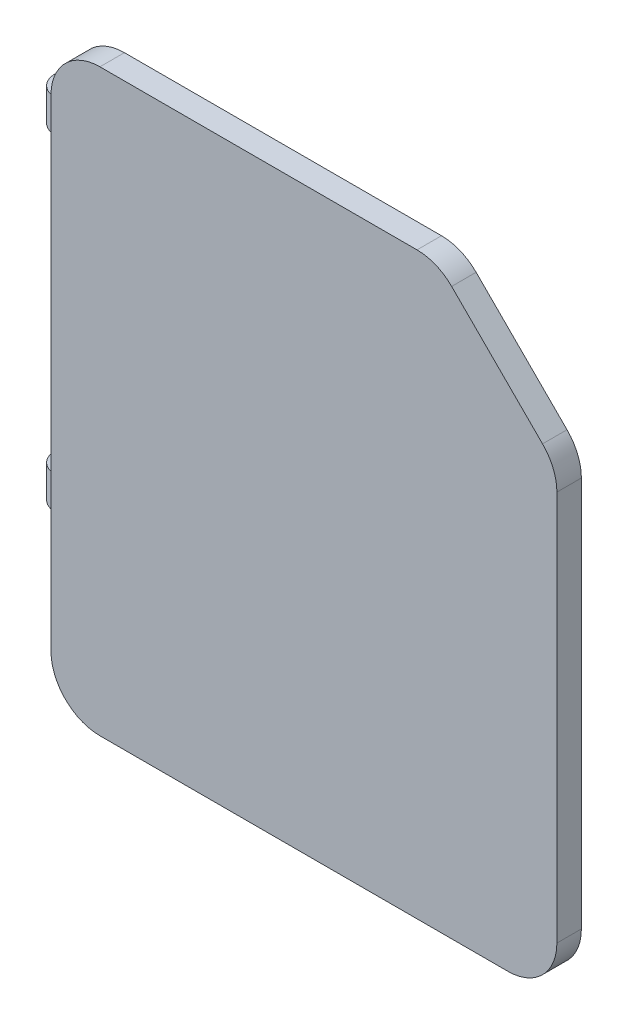
from build123d import *

# Parameters (mm, degrees)
BOSS_EXTRUDE1_DEPTH      = 15
BOSS_EXTRUDE2_DEPTH      = 10
BOSS_EXTRUDE2_DEPTH_BACK = 10
SKETCH3_R                = 12.5
SKETCH3_R_2              = 10
BOSS_EXTRUDE3_DEPTH      = 10
BOSS_EXTRUDE3_DEPTH_BACK = 10
SKETCH4_R                = 12.5
SKETCH4_R_2              = 10
CUT_EXTRUDE1_DEPTH       = 46
SKETCH6_R                = 7.5
BOSS_EXTRUDE4_DEPTH      = 10
BOSS_EXTRUDE5_DEPTH      = 5


with BuildPart() as part:
    # Sketch1 → Boss-Extrude1 (new body)
    with BuildSketch(Plane.XY):
        Polygon((-155, 155), (-155, -200), (155, -200), (155, 81.722524266), (81.722524266, 155), align=None)
    extrude(amount=BOSS_EXTRUDE1_DEPTH)

    # Sketch3 → Boss-Extrude2 (add, two sides: drawn at the far end of the back side and taken through both)
    # profile 1 of 2: a face of its own
    with BuildSketch(Plane(origin=(0, 100, 0), x_dir=(1, 0, 0), z_dir=(0, 1, 0)).offset(-BOSS_EXTRUDE2_DEPTH_BACK)):
        with BuildLine():
            ThreePointArc((-155, 12.5), (-158.661165235, 3.661165235), (-167.5, 0))
            Line((-167.5, 0), (-107.5, 0))
            Line((-107.5, 0), (-162.508319468, 23.960066556))
            ThreePointArc((-162.508319468, 23.960066556), (-157.04423588, 19.350328216), (-155, 12.5))
        make_face()
    # profile 2 of 2: a face of its own
    with BuildSketch(Plane(origin=(0, 100, 0), x_dir=(1, 0, 0), z_dir=(0, 1, 0)).offset(-BOSS_EXTRUDE2_DEPTH_BACK)):
        with Locations((-167.5, 12.5)):
            Circle(SKETCH3_R)
        with Locations(Location((-167.5, 12.5, 0), (0, 0, 270))):
            Circle(SKETCH3_R_2, mode=Mode.SUBTRACT)
    extrude(amount=BOSS_EXTRUDE2_DEPTH + BOSS_EXTRUDE2_DEPTH_BACK)

    # Sketch4 → Boss-Extrude3 (add, two sides: drawn at the far end of the back side and taken through both)
    # profile 1 of 2: a face of its own
    with BuildSketch(Plane(origin=(0, -100, 0), x_dir=(1, 0, 0), z_dir=(0, 1, 0)).offset(-BOSS_EXTRUDE3_DEPTH_BACK)):
        with Locations((-167.5, 12.5)):
            Circle(SKETCH4_R)
        with Locations(Location((-167.5, 12.5, 0), (0, 0, 270))):
            Circle(SKETCH4_R_2, mode=Mode.SUBTRACT)
    # profile 2 of 2: a face of its own
    with BuildSketch(Plane(origin=(0, -100, 0), x_dir=(1, 0, 0), z_dir=(0, 1, 0)).offset(-BOSS_EXTRUDE3_DEPTH_BACK)):
        with BuildLine():
            Line((-107.5, 0), (-162.508319468, 23.960066556))
            ThreePointArc((-162.508319468, 23.960066556), (-157.04423588, 19.350328216), (-155, 12.5))
            ThreePointArc((-155, 12.5), (-158.661165235, 3.661165235), (-167.5, 0))
            Line((-167.5, 0), (-107.5, 0))
        make_face()
    extrude(amount=BOSS_EXTRUDE3_DEPTH + BOSS_EXTRUDE3_DEPTH_BACK)

    # Sketch5 → Cut-Extrude1 (cut)
    with BuildSketch(Plane(origin=(0, 0, 0), x_dir=(-1, 0, 0), z_dir=(0, 0, -1))):
        with BuildLine():
            ThreePointArc((-125, -200), (-146.213203436, -191.213203436), (-155, -170))
            Line((-155, -170), (-155, -200))
            Line((-155, -200), (-125, -200))
        make_face()
        with BuildLine():
            ThreePointArc((155, -170), (146.213203436, -191.213203436), (125, -200))
            Line((125, -200), (155, -200))
            Line((155, -200), (155, -170))
        make_face()
        with BuildLine():
            Line((155, 155), (125, 155))
            ThreePointArc((125, 155), (146.213203436, 146.213203436), (155, 125))
            Line((155, 125), (155, 155))
        make_face()
        with BuildLine():
            Line((-81.722524266, 155), (-90.50932083, 146.213203436))
            ThreePointArc((-90.50932083, 146.213203436), (-80.776620365, 152.716385975), (-69.296117394, 155))
            Line((-69.296117394, 155), (-81.722524266, 155))
        make_face()
        with BuildLine():
            ThreePointArc((-155, 69.296117394), (-152.716385975, 80.776620365), (-146.213203436, 90.50932083))
            Line((-146.213203436, 90.50932083), (-155, 81.722524266))
            Line((-155, 81.722524266), (-155, 69.296117394))
        make_face()
    extrude(amount=-CUT_EXTRUDE1_DEPTH, mode=Mode.SUBTRACT)

    # Sketch6 → Boss-Extrude4 (add)
    with BuildSketch(Plane(origin=(0, 0, 0), x_dir=(-1, 0, 0), z_dir=(0, 0, -1))):
        with Locations(Location((-125, 40, 0), (0, 0, 180))):
            Circle(SKETCH6_R)
        with Locations(Location((-125, -40, 0), (0, 0, 180))):
            Circle(SKETCH6_R)
    extrude(amount=BOSS_EXTRUDE4_DEPTH)

    # Sketch7 → Boss-Extrude5 (add)
    with BuildSketch(Plane(origin=(0, 0, -10), x_dir=(-1, 0, 0), z_dir=(0, 0, -1))):
        with BuildLine():
            Line((-130, 50), (-120, 50))
            ThreePointArc((-120, 50), (-116.464466094, 48.535533906), (-115, 45))
            Line((-115, 45), (-115, -45))
            ThreePointArc((-115, -45), (-116.464466094, -48.535533906), (-120, -50))
            Line((-120, -50), (-130, -50))
            ThreePointArc((-130, -50), (-133.535533906, -48.535533906), (-135, -45))
            Line((-135, -45), (-135, 45))
            ThreePointArc((-135, 45), (-133.535533906, 48.535533906), (-130, 50))
        make_face()
    extrude(amount=BOSS_EXTRUDE5_DEPTH)


solid = part.part
